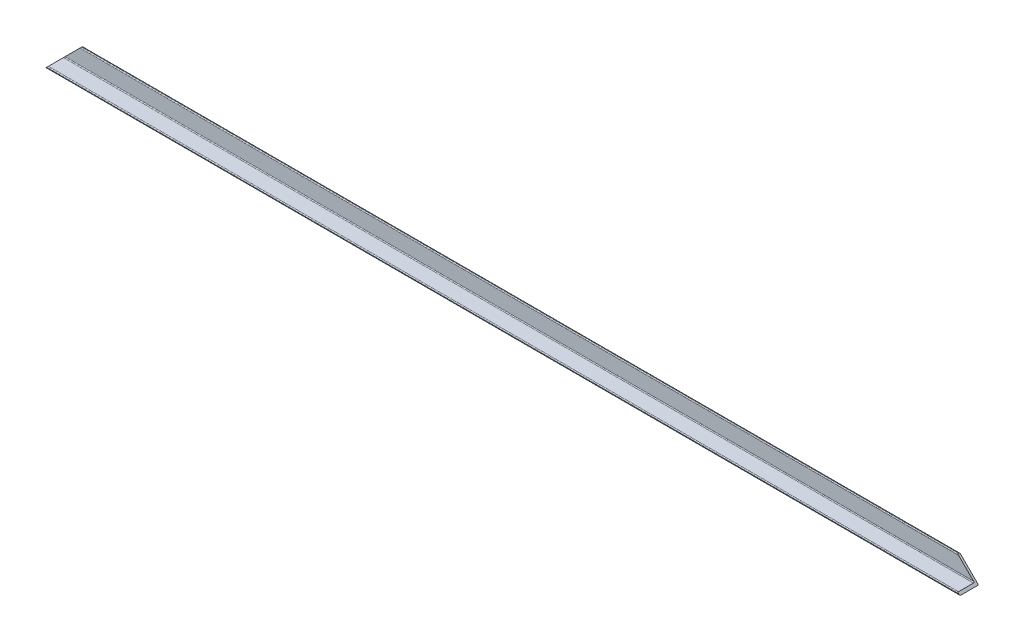
from build123d import *

# Parameters (mm, degrees)
SKETCH1_W               = 1115
SKETCH1_H               = 22.5
BOSS_EXTRUDE1_DEPTH     = 2.5
SKETCH2_W               = 1115
SKETCH2_H               = 2.5
BOSS_EXTRUDE2_DEPTH     = 20
CUT_EXTRUDE1_DEPTH      = 559.312188654
CUT_EXTRUDE1_DEPTH_BACK = 25
FILLET2_R               = 1


with BuildPart() as part:
    # Sketch1 → Boss-Extrude1 (new body)
    with BuildSketch(Plane(origin=(0, 0, 0), x_dir=(1, 0, 0), z_dir=(0, 1, 0))):
        Rectangle(SKETCH1_W, SKETCH1_H)
    extrude(amount=BOSS_EXTRUDE1_DEPTH)

    # Sketch2 → Boss-Extrude2 (add)
    with BuildSketch(Plane(origin=(0, 2.5, 0), x_dir=(1, 0, 0), z_dir=(0, 1, 0))):
        with Locations((0, 10)):
            Rectangle(SKETCH2_W, SKETCH2_H)
    extrude(amount=BOSS_EXTRUDE2_DEPTH)

    # Sketch3 → Cut-Extrude1 (cut, two sides: drawn at the far end of the back side and taken through both)
    with BuildSketch(Plane.XY.offset(-8.75).offset(-CUT_EXTRUDE1_DEPTH_BACK)):
        Polygon((-557.5, 22.5), (-557.5, -7.5), (-527.5, 22.5), align=None)
        Polygon((557.5, 22.5), (557.5, -7.5), (527.5, 22.5), align=None)
    extrude(amount=CUT_EXTRUDE1_DEPTH + CUT_EXTRUDE1_DEPTH_BACK, mode=Mode.SUBTRACT)

    # Fillet2
    fillet2_edges = [part.edges().sort_by_distance(p)[0] for p in [
        (0, 22.5, -8.75),
        (0, 2.5, -8.75),
        (0, 0, 11.25),
        (0, 2.5, 11.25),
        (0, 22.5, -11.25),
        (0, 0, -11.25),
    ]]
    fillet(fillet2_edges, radius=FILLET2_R)


solid = part.part
